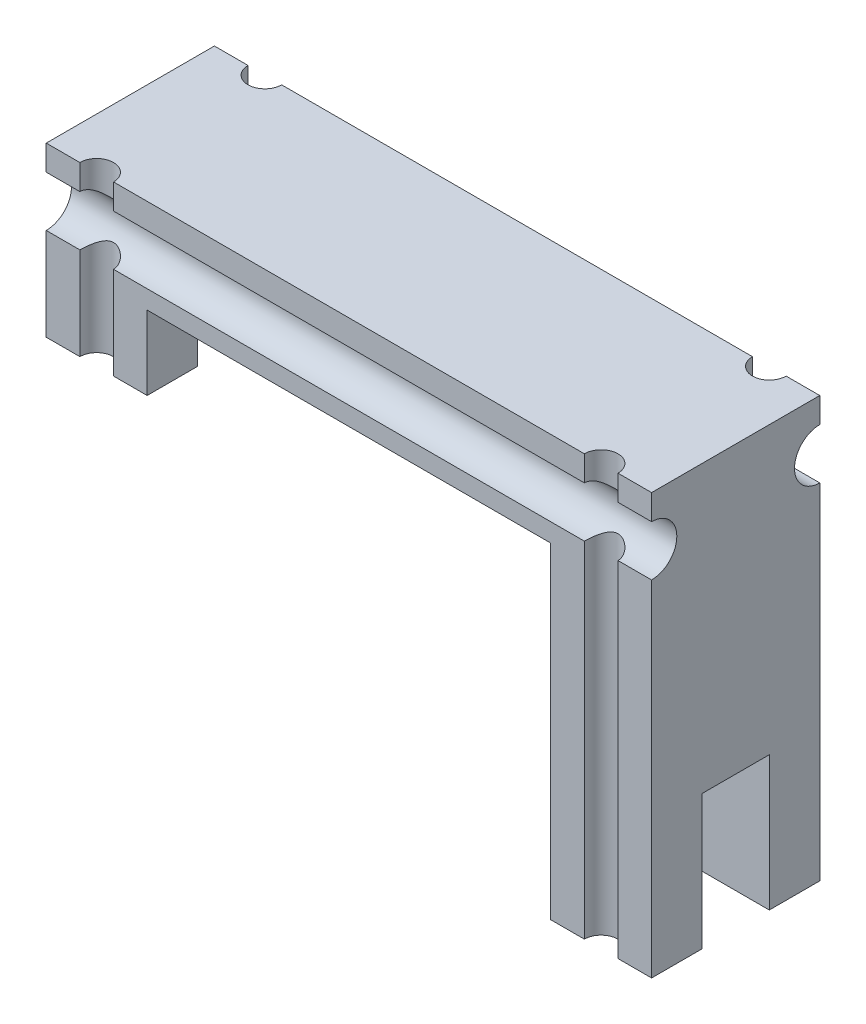
from build123d import *

# Parameters (mm, degrees)
SKETCH_1_W          = 180
SKETCH_1_H          = 110
EXTRUDE_1_DEPTH     = 30
SKETCH_2_W          = 150
SKETCH_2_H          = 75
CUT_EXTRUDE_1_DEPTH = 30
SKETCH_3_W          = 20
SKETCH_3_H          = 40
CUT_EXTRUDE_2_DEPTH = 150
SKETCH_4_W          = 20
SKETCH_4_H          = 80
CUT_EXTRUDE_3_DEPTH = 30
SKETCH_5_W          = 120
SKETCH_5_H          = 22
CUT_EXTRUDE_4_DEPTH = 30
SKETCH_6_W          = 100
SKETCH_6_H          = 10
CUT_EXTRUDE_5_DEPTH = 64
EXTRUDE_2_DEPTH     = 10
EXTRUDE_3_DEPTH     = 10
SKETCH_9_W          = 180
SKETCH_9_H          = 50
EXTRUDE_4_DEPTH     = 15
SKETCH_10_R         = 5
CUT_EXTRUDE_6_DEPTH = 144
SKETCH_11_R         = 7.5
CUT_EXTRUDE_7_DEPTH = 191


with BuildPart() as part:
    # 草图1 → 凸台-拉伸1 (new body)
    with BuildSketch(Plane.XY):
        Rectangle(SKETCH_1_W, SKETCH_1_H)
    extrude(amount=EXTRUDE_1_DEPTH)

    # 草图2 → 切除-拉伸1 (cut)
    with BuildSketch(Plane.XY.offset(30)):
        with Locations((-15, -17.5)):
            Rectangle(SKETCH_2_W, SKETCH_2_H)
    extrude(amount=-CUT_EXTRUDE_1_DEPTH, mode=Mode.SUBTRACT)

    # 草图3 → 切除-拉伸2 (cut)
    with BuildSketch(Plane.ZY.offset(90)):
        with Locations((15, 20)):
            Rectangle(SKETCH_3_W, SKETCH_3_H)
    extrude(amount=-CUT_EXTRUDE_2_DEPTH, mode=Mode.SUBTRACT)

    # 草图4 → 切除-拉伸3 (cut)
    with BuildSketch(Plane.ZY.offset(-60)):
        with Locations((15, -55)):
            Rectangle(SKETCH_4_W, SKETCH_4_H)
    extrude(amount=-CUT_EXTRUDE_3_DEPTH, mode=Mode.SUBTRACT)

    # 草图5 → 切除-拉伸4 (cut)
    with BuildSketch(Plane.XY.offset(30)):
        with Locations((0, 31)):
            Rectangle(SKETCH_5_W, SKETCH_5_H)
    extrude(amount=-CUT_EXTRUDE_4_DEPTH, mode=Mode.SUBTRACT)

    # 草图6 → 切除-拉伸5 (cut)
    with BuildSketch(Plane.XZ.offset(15)):
        with Locations((0, 15)):
            Rectangle(SKETCH_6_W, SKETCH_6_H)
    extrude(amount=-CUT_EXTRUDE_5_DEPTH, mode=Mode.SUBTRACT)

    # 草图7 → 凸台-拉伸2 (add)
    with BuildSketch(Plane(origin=(0, 0, 0), x_dir=(-1, 0, 0), z_dir=(0, 0, -1))):
        Polygon((-60, 42), (60, 42), (60, 20), (90, 20), (90, 55), (-90, 55), (-90, -55), (-60, -55), align=None)
    extrude(amount=EXTRUDE_2_DEPTH)

    # 草图8 → 凸台-拉伸3 (add)
    with BuildSketch(Plane.XY.offset(30)):
        Polygon((-60, 20), (-60, 42), (60, 42), (60, -55), (90, -55), (90, 55), (-90, 55), (-90, 20), align=None)
    extrude(amount=EXTRUDE_3_DEPTH)

    # 草图9 → 凸台-拉伸4 (add)
    with BuildSketch(Plane(origin=(0, 55, 0), x_dir=(1, 0, 0), z_dir=(0, 1, 0))):
        with Locations((0, -15)):
            Rectangle(SKETCH_9_W, SKETCH_9_H)
    extrude(amount=EXTRUDE_4_DEPTH)

    # 草图10 → 切除-拉伸6 (cut)
    with BuildSketch(Plane.XZ.offset(55)):
        with Locations((75, 40)):
            Circle(SKETCH_10_R)
        with Locations((75, -10)):
            Circle(SKETCH_10_R)
        with Locations((-75, 40)):
            Circle(SKETCH_10_R)
        with Locations((-75, -10)):
            Circle(SKETCH_10_R)
    extrude(amount=-CUT_EXTRUDE_6_DEPTH, mode=Mode.SUBTRACT)

    # 草图11 → 切除-拉伸7 (cut)
    with BuildSketch(Plane.ZY.offset(90)):
        with Locations((40, 55)):
            Circle(SKETCH_11_R)
        with Locations((-10, 55)):
            Circle(SKETCH_11_R)
    extrude(amount=-CUT_EXTRUDE_7_DEPTH, mode=Mode.SUBTRACT)


solid = part.part
